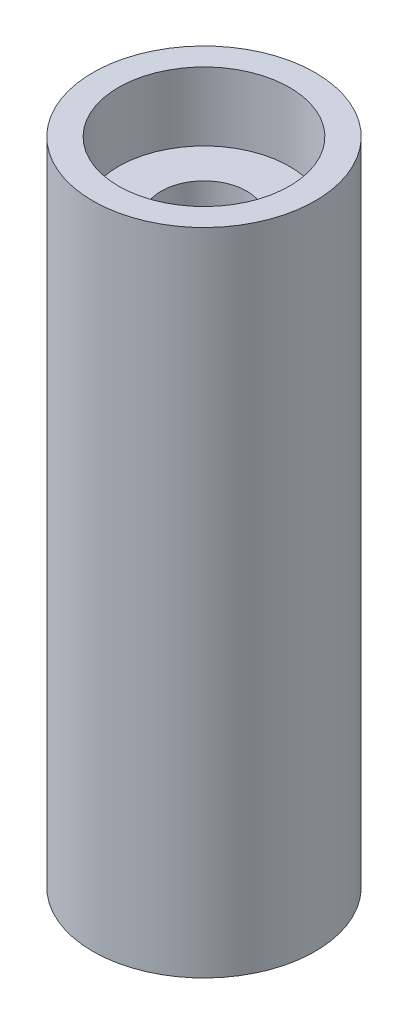
from build123d import *

# Parameters (mm, degrees)
SKETCH_1_R          = 6.5
SKETCH_1_R_2        = 2.5
EXTRUDE_2_DEPTH     = 19
SKETCH_2_R          = 5
CUT_EXTRUDE_1_DEPTH = 4


with BuildPart() as part:
    # 草图1 → 凸台-拉伸2 (new, symmetric)
    with BuildSketch(Plane(origin=(0, 0, 0), x_dir=(1, 0, 0), z_dir=(0, 1, 0))):
        with Locations(Location((0, 0, 0), (0, 0, 270))):
            Circle(SKETCH_1_R)
        with Locations(Location((0, 0, 0), (0, 0, 270))):
            Circle(SKETCH_1_R_2, mode=Mode.SUBTRACT)
    extrude(amount=EXTRUDE_2_DEPTH, both=True)

    # 草图2 → 切除-拉伸1 (cut)
    with BuildSketch(Plane(origin=(0, 19, 0), x_dir=(1, 0, 0), z_dir=(0, 1, 0))):
        with Locations(Location((0, 0, 0), (0, 0, 270))):
            Circle(SKETCH_2_R)
    cut_extrude_1 = extrude(amount=-CUT_EXTRUDE_1_DEPTH, mode=Mode.SUBTRACT)

    # 镜向1: 切除-拉伸1 across plane
    add(cut_extrude_1.mirror(Plane.ZX), mode=Mode.SUBTRACT)


solid = part.part
